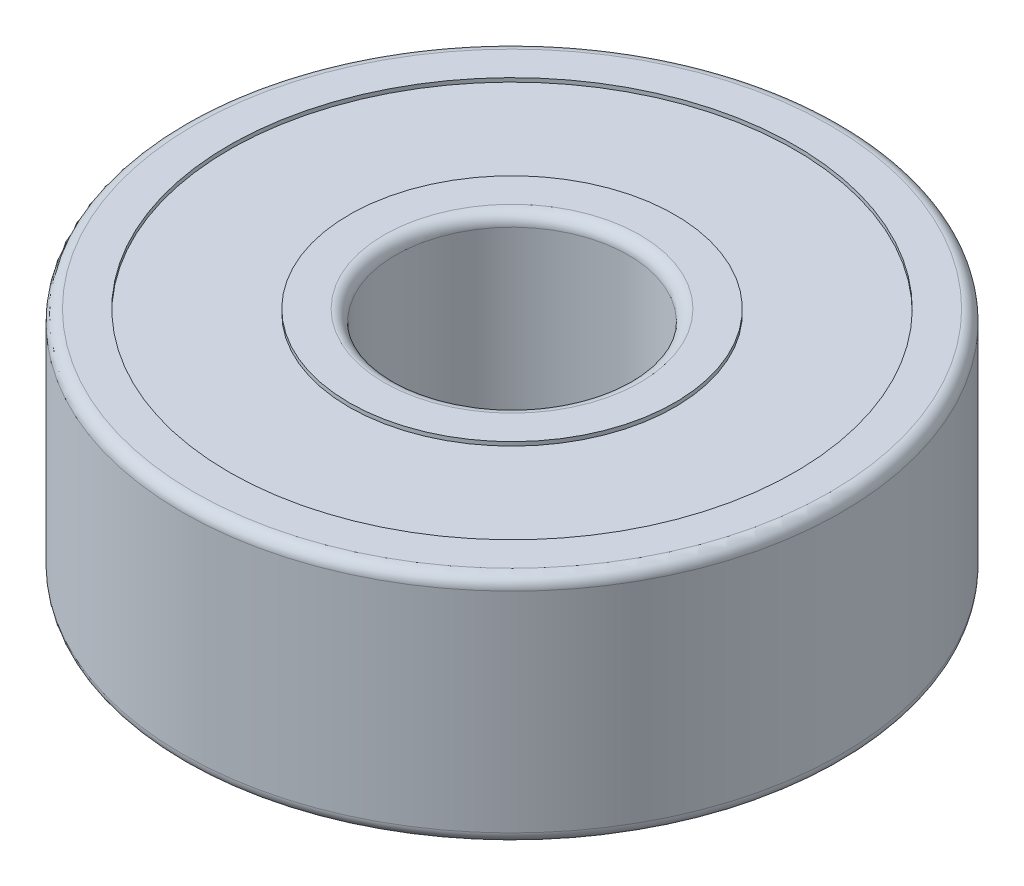
from build123d import *

# Parameters (mm, degrees)
CROQUIS1_R              = 8.5
CROQUIS1_R_2            = 3
SALIENTE_EXTRUIR1_DEPTH = 6
CROQUIS2_R              = 7.3
CROQUIS2_R_2            = 4.2
CORTAR_EXTRUIR1_DEPTH   = 0.1
REDONDEO1_R             = 0.3


with BuildPart() as part:
    # Croquis1 → Saliente-Extruir1 (new body)
    with BuildSketch(Plane(origin=(0, 0, 0), x_dir=(1, 0, 0), z_dir=(0, 1, 0))):
        with Locations(Location((0, 0, 0), (0, 0, 270))):
            Circle(CROQUIS1_R)
        with Locations(Location((0, 0, 0), (0, 0, 270))):
            Circle(CROQUIS1_R_2, mode=Mode.SUBTRACT)
    extrude(amount=SALIENTE_EXTRUIR1_DEPTH)

    # Croquis2 → Cortar-Extruir1 (cut)
    with BuildSketch(Plane(origin=(0, 6, 0), x_dir=(1, 0, 0), z_dir=(0, 1, 0))):
        with Locations(Location((0, 0, 0), (0, 0, 270))):
            Circle(CROQUIS2_R)
        with Locations(Location((0, 0, 0), (0, 0, 270))):
            Circle(CROQUIS2_R_2, mode=Mode.SUBTRACT)
    cortar_extruir1 = extrude(amount=-CORTAR_EXTRUIR1_DEPTH, mode=Mode.SUBTRACT)

    # Simetría1: Cortar-Extruir1 across plane
    add(cortar_extruir1.mirror(Plane.ZX.offset(3)), mode=Mode.SUBTRACT)

    # Redondeo1
    redondeo1_edges = [part.edges().sort_by_distance(p)[0] for p in [
        (0, 0, -8.5),
        (0, 6, -8.5),
        (0, 0, -3),
        (0, 6, -3),
    ]]
    fillet(redondeo1_edges, radius=REDONDEO1_R)


solid = part.part
